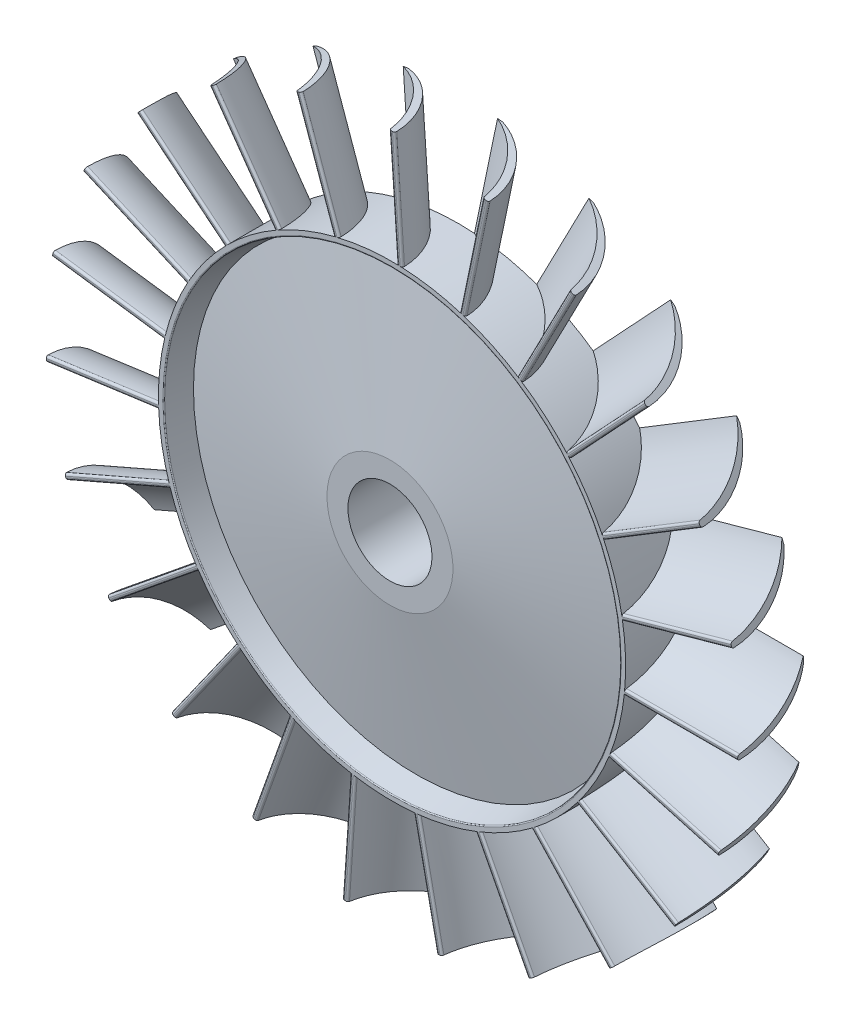
from build123d import *

# Parameters (mm, degrees)
FILLET3_R           = 0.1
FILLET4_R           = 0.1
BOSS_EXTRUDE1_DEPTH = 11
CIRPATTERN1_COUNT   = 23
SKETCH3_R           = 34
SKETCH3_R_2         = 33
CUT_EXTRUDE1_DEPTH  = 11.5


with BuildPart() as part:
    # Sketch1 → Revolve1 (revolve)
    with BuildSketch(Plane(origin=(0, 0, 0), x_dir=(1, 0, 0), z_dir=(0, 1, 0))):
        Polygon((-4, 3.35), (-4, -3.35), (-6, -3.35), (-21.205671407, -0.858020354), (-21.75, -3.15), (-22.25, -3.15), (-22.25, 3.15), (-21.75, 3.15), (-21.205671407, 0.858020354), (-6, 3.35), align=None)
    revolve(axis=Axis((0, 0, 0), (0, 0, 1)))

    # Fillet3
    fillet3_edges = [part.edges().sort_by_distance(p)[0] for p in [
        (21.75, 0, -3.15),
    ]]
    fillet(fillet3_edges, radius=FILLET3_R)

    # Fillet4
    fillet4_edges = [part.edges().sort_by_distance(p)[0] for p in [
        (21.75, 0, 3.15),
    ]]
    fillet(fillet4_edges, radius=FILLET4_R)

    # Sketch2 → Boss-Extrude1 (add)
    with BuildSketch(Plane(origin=(22, 0, 0), x_dir=(0, 0, -1), z_dir=(1, 0, 0))):
        with BuildLine():
            Line((-3.15, -2.296475505), (-3.15, -2.17455184))
            ThreePointArc((-3.15, -2.17455184), (-3.101407674, -2.043877756), (-2.979242837, -1.976701249))
            ThreePointArc((-2.979242837, -1.976701249), (0.76769298, -0.32868048), (3.15, 3))
            Line((3.15, 3), (3.15, 2.5))
            ThreePointArc((3.15, 2.5), (0.949653001, -1.030282664), (-2.94329331, -2.496363025))
            ThreePointArc((-2.94329331, -2.496363025), (-3.089029964, -2.440248483), (-3.15, -2.296475505))
        make_face()
    boss_extrude1 = extrude(amount=BOSS_EXTRUDE1_DEPTH)

    # CirPattern1: Boss-Extrude1 ×23 about axis
    cirpattern1_axis = Axis((0, 0, 0), (0, 0, 1))
    for i in range(1, CIRPATTERN1_COUNT):
        add(boss_extrude1.rotate(cirpattern1_axis, i * 360 / CIRPATTERN1_COUNT))

    # Sketch3 → Cut-Extrude1 (cut)
    with BuildSketch(Plane.XY.offset(3.35)):
        Circle(SKETCH3_R)
        Circle(SKETCH3_R_2, mode=Mode.SUBTRACT)
    extrude(amount=-CUT_EXTRUDE1_DEPTH, mode=Mode.SUBTRACT)


solid = part.part
